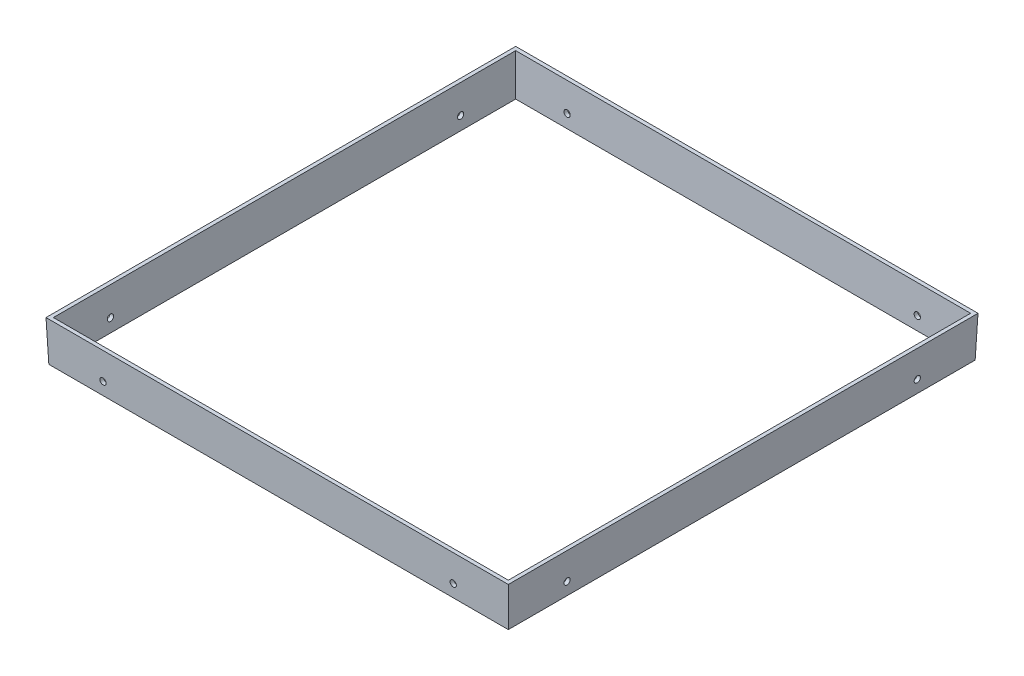
from build123d import *

# Parameters (mm, degrees)
SKETCH2_W           = 249.3
SKETCH2_H           = 253.3
BOSS_EXTRUDE1_DEPTH = 22
BOSS_EXTRUDE1_DRAFT = -2
SHELL1_T            = -2
SKETCH4_R           = 1.7
CUT_EXTRUDE1_DEPTH  = 292
SKETCH5_R           = 1.7
CUT_EXTRUDE2_DEPTH  = 292


with BuildPart() as part:
    # Sketch2 → Boss-Extrude1 (with draft: the straight prism first)
    with BuildSketch(Plane(origin=(0, 0, 0), x_dir=(1, 0, 0), z_dir=(0, 1, 0))):
        Rectangle(SKETCH2_W, SKETCH2_H)
    extrude(amount=BOSS_EXTRUDE1_DEPTH)
    # Boss-Extrude1: the draft: its side faces are tilted about the plane it starts from
    boss_extrude1_sides = [part.faces().sort_by_distance(p)[0] for p in [
        (0, 11, 126.65),
        (124.65, 11, 0),
        (0, 11, -126.65),
        (-124.65, 11, 0),
    ]]
    draft(boss_extrude1_sides, Plane(origin=(0, 0, 0), x_dir=(1, 0, 0), z_dir=(0, 1, 0)), BOSS_EXTRUDE1_DRAFT)

    # Shell1
    shell1_openings = [part.faces().sort_by_distance(p)[0] for p in [
        (0, 22, 0),
        (0, 0, 0),
    ]]
    offset(amount=SHELL1_T, openings=shell1_openings, kind=Kind.INTERSECTION)

    # Sketch4 → Cut-Extrude1 (cut, along a direction that is not the sketch's normal)
    with BuildSketch(Plane(origin=(124.498179432, -4.347572226, 0), x_dir=(0, 0, -1), z_dir=(0.9993908270190958, -0.03489949670250105, 0))):
        with Locations((-95, 11.2937907)):
            Circle(SKETCH4_R)
        with Locations((95, 11.2937907)):
            Circle(SKETCH4_R)
    extrude(amount=-CUT_EXTRUDE1_DEPTH, dir=(1, 0, 0), mode=Mode.SUBTRACT)

    # Sketch5 → Cut-Extrude2 (cut, along a direction that is not the sketch's normal)
    with BuildSketch(Plane(origin=(0, -4.4173287, -126.495743483), x_dir=(-1, 0, 0), z_dir=(0, -0.03489949670250106, -0.9993908270190958))):
        with Locations((-95, 11.363589693)):
            Circle(SKETCH5_R)
        with Locations((95, 11.363589693)):
            Circle(SKETCH5_R)
    extrude(amount=-CUT_EXTRUDE2_DEPTH, dir=(0, 0, -1), mode=Mode.SUBTRACT)


solid = part.part
